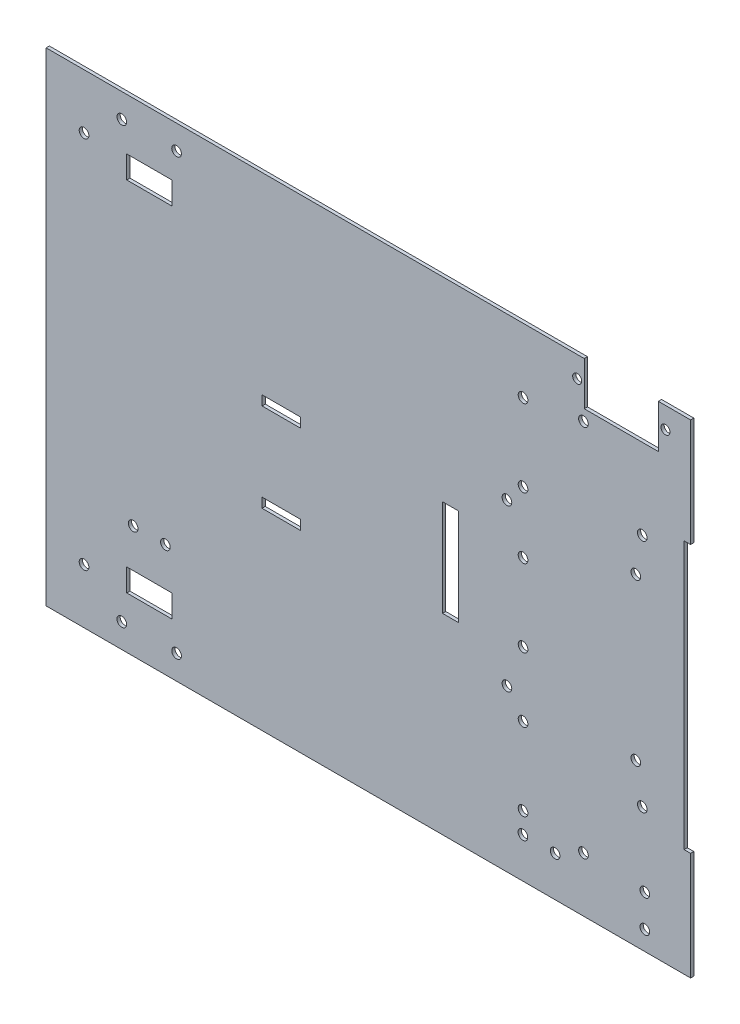
from build123d import *

# Parameters (mm, degrees)
SKETCH1_W           = 200
SKETCH1_H           = 150
BOSS_EXTRUDE1_DEPTH = 1
SKETCH2_R           = 1.5
SKETCH2_R_2         = 1.4
SKETCH2_W           = 14
SKETCH2_H           = 7
SKETCH2_W_2         = 12
SKETCH2_H_2         = 3
SKETCH2_W_3         = 23
SKETCH2_H_3         = 13.5
SKETCH2_W_4         = 2
SKETCH2_H_4         = 83
CUT_EXTRUDE1_DEPTH  = 1
SKETCH3_R           = 1.5
SKETCH3_W           = 5
SKETCH3_H           = 30
CUT_EXTRUDE2_DEPTH  = 10
SKETCH4_R           = 1.5
CUT_EXTRUDE3_DEPTH  = 10


with BuildPart() as part:
    # Sketch1 → Boss-Extrude1 (new body)
    with BuildSketch(Plane.XY):
        Rectangle(SKETCH1_W, SKETCH1_H)
    extrude(amount=BOSS_EXTRUDE1_DEPTH)

    # Sketch2 → Cut-Extrude1 (cut)
    with BuildSketch(Plane.XY.offset(1)):
        with Locations((-76.53, -67.5)):
            Circle(SKETCH2_R)
        with Locations((-59.53, -67.5)):
            Circle(SKETCH2_R)
        with Locations(Location((-59.53, 67.5, 0), (0, 0, 180))):
            Circle(SKETCH2_R)
        with Locations(Location((-76.53, 67.5, 0), (0, 0, 180))):
            Circle(SKETCH2_R)
        with Locations((-73, -40)):
            Circle(SKETCH2_R)
        with Locations((-63, -40)):
            Circle(SKETCH2_R)
        with Locations((-88.25346752, -58)):
            Circle(SKETCH2_R)
        with Locations((66.74653248, -58)):
            Circle(SKETCH2_R)
        with Locations(Location((66.74653248, 58, 0), (0, 0, 180))):
            Circle(SKETCH2_R)
        with Locations(Location((-88.25346752, 58, 0), (0, 0, 180))):
            Circle(SKETCH2_R)
        with Locations((64.8, 68.5)):
            Circle(SKETCH2_R_2)
        with Locations((92.2, 68.5)):
            Circle(SKETCH2_R_2)
        with Locations((85, 36.5)):
            Circle(SKETCH2_R)
        with Locations((85, -36.5)):
            Circle(SKETCH2_R)
        with Locations((-68, -55.5)):
            Rectangle(SKETCH2_W, SKETCH2_H)
        with Locations((-68, 55.5)):
            Rectangle(SKETCH2_W, SKETCH2_H)
        with Locations((-27, -13.75)):
            Rectangle(SKETCH2_W_2, SKETCH2_H_2)
        with Locations((-27, 13.75)):
            Rectangle(SKETCH2_W_2, SKETCH2_H_2)
        with Locations((78.5, 68.25)):
            Rectangle(SKETCH2_W_3, SKETCH2_H_3)
        with Locations((99, 0)):
            Rectangle(SKETCH2_W_4, SKETCH2_H_4)
    extrude(amount=-CUT_EXTRUDE1_DEPTH, mode=Mode.SUBTRACT)

    # Sketch3 → Cut-Extrude2 (cut)
    with BuildSketch(Plane.XY.offset(1)):
        with Locations((85.8, -69.04)):
            Circle(SKETCH3_R)
        with Locations((85.8, -59.04)):
            Circle(SKETCH3_R)
        with Locations((57.96, -62.5)):
            Circle(SKETCH3_R)
        with Locations((47.96, -62.5)):
            Circle(SKETCH3_R)
        with Locations((25.5, -0.49)):
            Rectangle(SKETCH3_W, SKETCH3_H)
    extrude(amount=-CUT_EXTRUDE2_DEPTH, mode=Mode.SUBTRACT)

    # Sketch4 → Cut-Extrude3 (cut)
    with BuildSketch(Plane.XY.offset(1)):
        with Locations((48, -12)):
            Circle(SKETCH4_R)
        with Locations((48, -56.04)):
            Circle(SKETCH4_R)
        with Locations((48, -32.04)):
            Circle(SKETCH4_R)
        with Locations((48, 12)):
            Circle(SKETCH4_R)
        with Locations((48, 31)):
            Circle(SKETCH4_R)
        with Locations((48, 55)):
            Circle(SKETCH4_R)
        with Locations((43, -25)):
            Circle(SKETCH4_R)
        with Locations((83, -25)):
            Circle(SKETCH4_R)
        with Locations((83, 25)):
            Circle(SKETCH4_R)
        with Locations((43, 25)):
            Circle(SKETCH4_R)
    extrude(amount=-CUT_EXTRUDE3_DEPTH, mode=Mode.SUBTRACT)


solid = part.part
